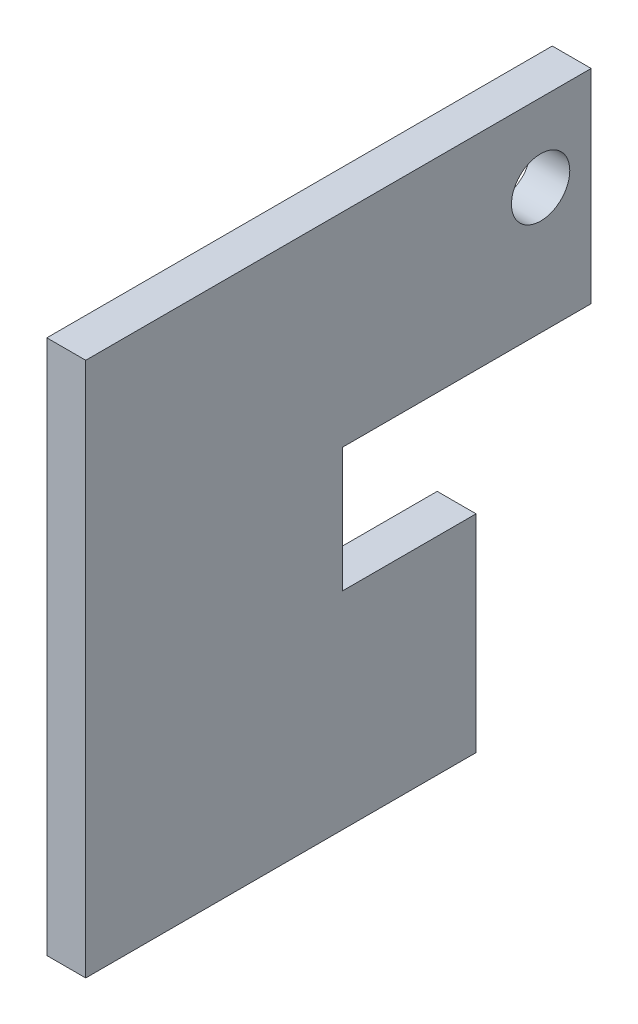
from build123d import *

# Parameters (mm, degrees)
SKETCH1_W           = 16.51
SKETCH1_H           = 17.4752
BOSS_EXTRUDE1_DEPTH = 1.27
SKETCH2_R           = 0.9525
CUT_EXTRUDE1_DEPTH  = 25.074376732
SKETCH4_W           = 1.27
SKETCH4_H           = 10.8204
CUT_EXTRUDE2_DEPTH  = 3.7592
SKETCH5_W           = 1.27
SKETCH5_H           = 4.064
CUT_EXTRUDE3_DEPTH  = 4.3688


with BuildPart() as part:
    # Sketch1 → Boss-Extrude1 (new body)
    with BuildSketch(Plane(origin=(0, 0, 0), x_dir=(0, 0, -1), z_dir=(1, 0, 0))):
        with Locations((-8.255, 8.7376)):
            Rectangle(SKETCH1_W, SKETCH1_H)
    extrude(amount=BOSS_EXTRUDE1_DEPTH)

    # Sketch2 → Cut-Extrude1 (cut, through all)
    with BuildSketch(Plane(origin=(1.27, 0, 0), x_dir=(0, 0, -1), z_dir=(1, 0, 0))):
        with Locations((-1.651, 14.9352)):
            Circle(SKETCH2_R)
    extrude(amount=-CUT_EXTRUDE1_DEPTH, mode=Mode.SUBTRACT)

    # Sketch4 → Cut-Extrude2 (cut)
    with BuildSketch(Plane(origin=(0, 0, 0), x_dir=(-1, 0, 0), z_dir=(0, 0, -1))):
        with Locations((-0.635, 5.4102)):
            Rectangle(SKETCH4_W, SKETCH4_H)
    extrude(amount=-CUT_EXTRUDE2_DEPTH, mode=Mode.SUBTRACT)

    # Sketch5 → Cut-Extrude3 (cut)
    with BuildSketch(Plane(origin=(0, 0, 3.7592), x_dir=(-1, 0, 0), z_dir=(0, 0, -1))):
        with Locations((-0.635, 8.7884)):
            Rectangle(SKETCH5_W, SKETCH5_H)
    extrude(amount=-CUT_EXTRUDE3_DEPTH, mode=Mode.SUBTRACT)


solid = part.part
